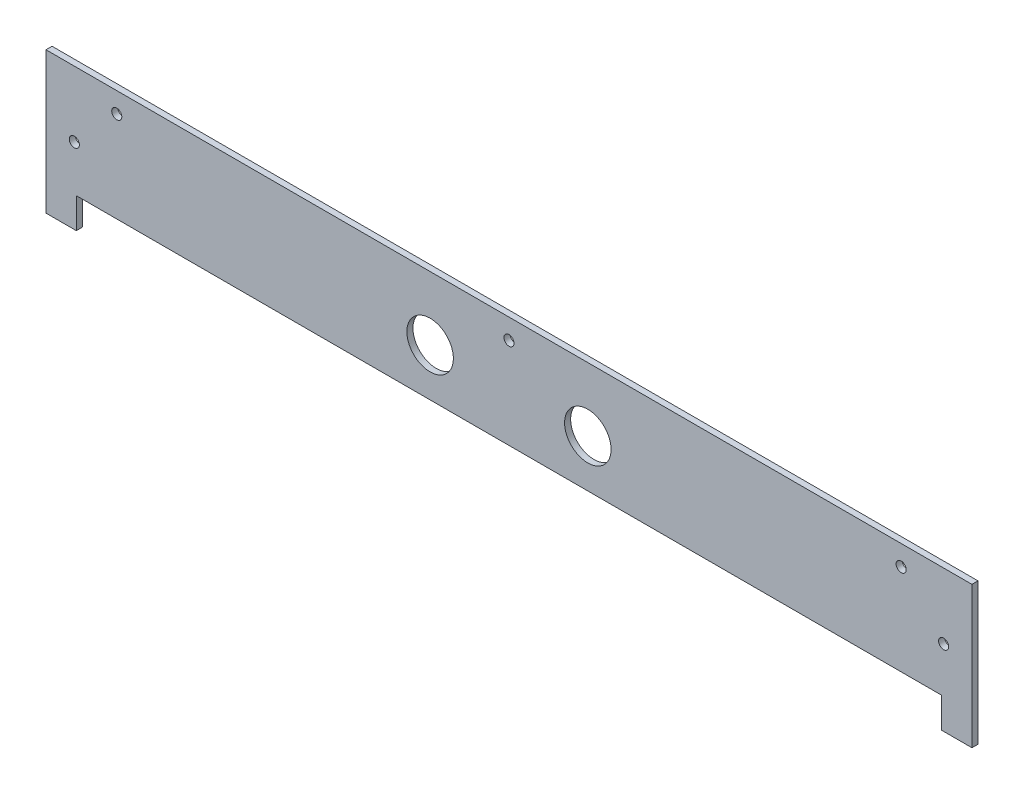
from build123d import *

# Parameters (mm, degrees)
SKETCH1_W           = 458
SKETCH1_H           = 245
BOSS_EXTRUDE1_DEPTH = 3
CUT_EXTRUDE1_DEPTH  = 260.723410574
SKETCH3_R           = 2.5
CUT_EXTRUDE2_DEPTH  = 260.723410574
SKETCH4_R           = 11.5
CUT_EXTRUDE3_DEPTH  = 260.723410574
SKETCH5_W           = 428
SKETCH5_H           = 29
CUT_EXTRUDE4_DEPTH  = 260.723410574
SKETCH8_R           = 1.5
SKETCH8_W           = 69.9
SKETCH8_H           = 41.2
CUT_EXTRUDE5_DEPTH  = 260.723410574
SKETCH9_W           = 458
SKETCH9_H           = 175
CUT_EXTRUDE7_DEPTH  = 10


with BuildPart() as part:
    # Sketch1 → Boss-Extrude1 (new body)
    with BuildSketch(Plane.XY):
        Rectangle(SKETCH1_W, SKETCH1_H)
    extrude(amount=BOSS_EXTRUDE1_DEPTH)

    # Sketch2 → Cut-Extrude1 (cut, through all)
    with BuildSketch(Plane.XY.offset(3)):
        with BuildLine():
            Line((-148, -107.5), (-148, -122.5))
            ThreePointArc((-148, -122.5), (-155, -129.5), (-162, -122.5))
            Line((-162, -122.5), (-162, -107.5))
            ThreePointArc((-162, -107.5), (-155, -100.5), (-148, -107.5))
        make_face()
        with BuildLine():
            Line((162, -107.5), (162, -122.5))
            ThreePointArc((162, -122.5), (155, -129.5), (148, -122.5))
            Line((148, -122.5), (148, -107.5))
            ThreePointArc((148, -107.5), (155, -100.5), (162, -107.5))
        make_face()
    extrude(amount=-CUT_EXTRUDE1_DEPTH, mode=Mode.SUBTRACT)

    # Sketch3 → Cut-Extrude2 (cut, through all)
    with BuildSketch(Plane.XY.offset(3)):
        with Locations((-194, 112.5)):
            Circle(SKETCH3_R)
        with Locations((-194, -107.5)):
            Circle(SKETCH3_R)
        with Locations((194, -107.5)):
            Circle(SKETCH3_R)
        with Locations((194, 112.5)):
            Circle(SKETCH3_R)
        with Locations((-215, 0)):
            Circle(SKETCH3_R)
        with Locations((-215, -90)):
            Circle(SKETCH3_R)
        with Locations((-215, 90)):
            Circle(SKETCH3_R)
        with Locations((215, 0)):
            Circle(SKETCH3_R)
        with Locations((215, -90)):
            Circle(SKETCH3_R)
        with Locations((215, 90)):
            Circle(SKETCH3_R)
        with Locations((0, 112.5)):
            Circle(SKETCH3_R)
        with Locations((0, -107.5)):
            Circle(SKETCH3_R)
    extrude(amount=-CUT_EXTRUDE2_DEPTH, mode=Mode.SUBTRACT)

    # Sketch4 → Cut-Extrude3 (cut, through all)
    with BuildSketch(Plane.XY.offset(3)):
        with Locations((-39, 91)):
            Circle(SKETCH4_R)
        with Locations((39, 91)):
            Circle(SKETCH4_R)
    extrude(amount=-CUT_EXTRUDE3_DEPTH, mode=Mode.SUBTRACT)

    # Sketch5 → Cut-Extrude4 (cut, through all)
    with BuildSketch(Plane.XY.offset(3)):
        with Locations((0, 53)):
            Rectangle(SKETCH5_W, SKETCH5_H)
    extrude(amount=-CUT_EXTRUDE4_DEPTH, mode=Mode.SUBTRACT)

    # Sketch8 → Cut-Extrude5 (cut, through all)
    with BuildSketch(Plane.XY.offset(3)):
        with Locations((5.296172264, 15.703565509)):
            Circle(SKETCH8_R)
        with Locations((5.679687501, -26.054673392)):
            Circle(SKETCH8_R)
        with Locations((-83.3, 14.88)):
            Circle(SKETCH8_R)
        with Locations((-83.367997673, -26.737946691)):
            Circle(SKETCH8_R)
        with Locations((-39, -5.5)):
            Rectangle(SKETCH8_W, SKETCH8_H)
    extrude(amount=-CUT_EXTRUDE5_DEPTH, mode=Mode.SUBTRACT)

    # Sketch9 → Cut-Extrude7 (cut)
    with BuildSketch(Plane.XY.offset(3)):
        with Locations((0, -35)):
            Rectangle(SKETCH9_W, SKETCH9_H)
    extrude(amount=-CUT_EXTRUDE7_DEPTH, mode=Mode.SUBTRACT)


solid = part.part
